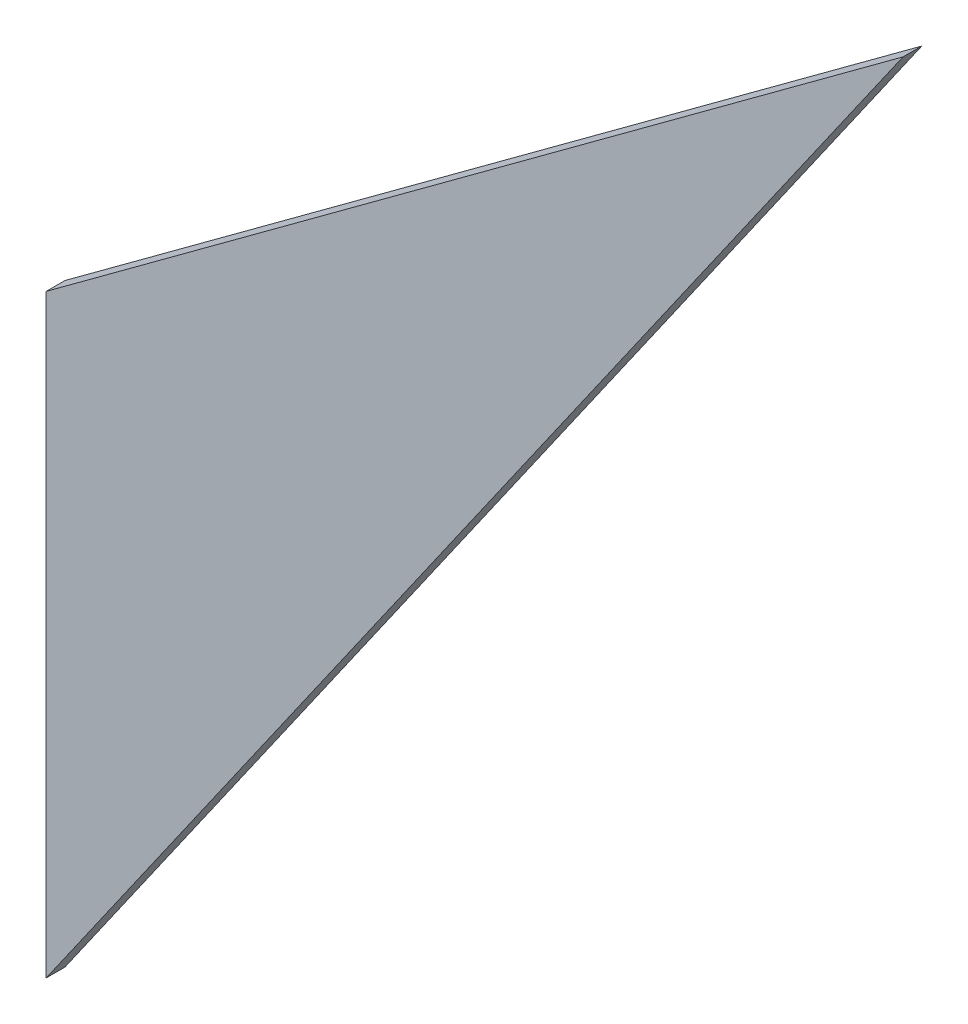
from build123d import *

# Parameters (mm, degrees)
BOSS_EXTRUDE1_DEPTH = 15


with BuildPart() as part:
    # Sketch1 → Boss-Extrude1 (new body)
    with BuildSketch(Plane.XY):
        Polygon((0, 0), (682.251359352, 976.235307108), (0, 473.42), align=None)
    extrude(amount=BOSS_EXTRUDE1_DEPTH)


solid = part.part
